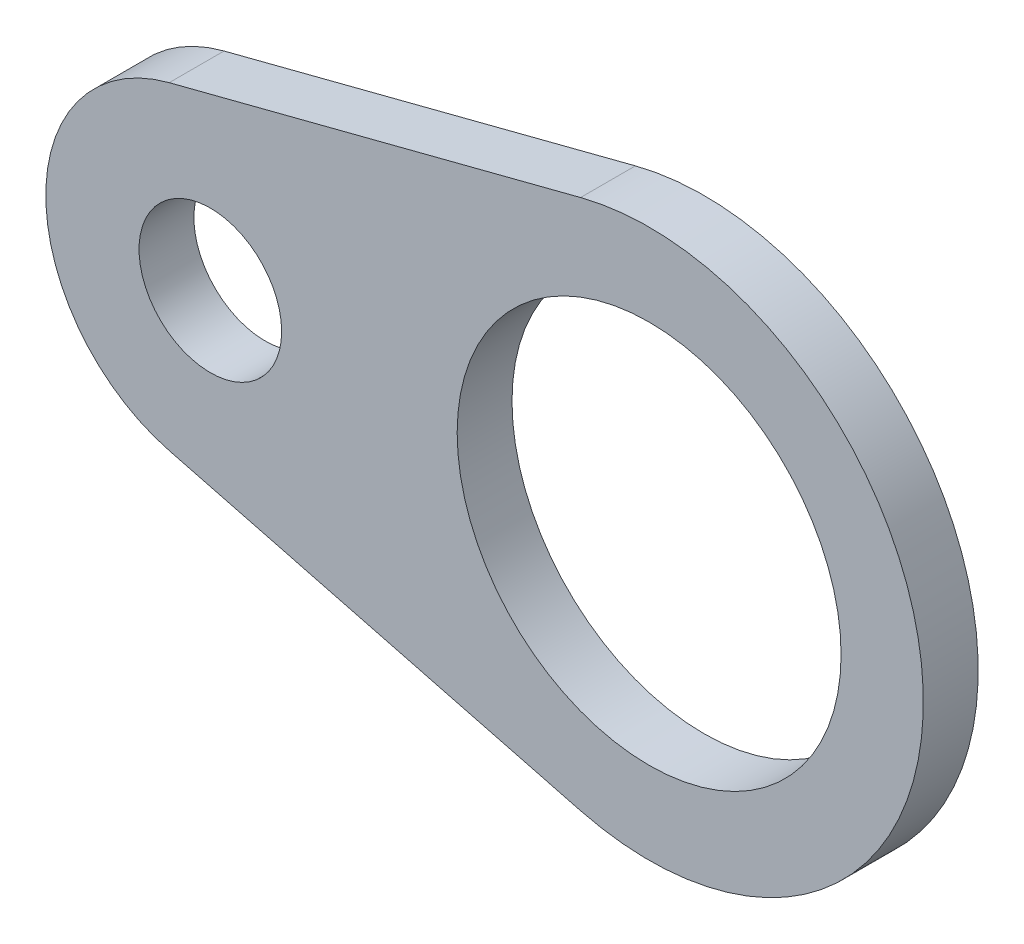
from build123d import *

# Parameters (mm, degrees)
SKETCH_1_R      = 17.5
SKETCH_1_R_2    = 6.5
EXTRUDE_1_DEPTH = 5


with BuildPart() as part:
    # 草图1 → 凸台-拉伸1 (new body)
    with BuildSketch(Plane.XY):
        with BuildLine():
            Line((-43.75, 14.523687548), (-6.25, 24.206145914))
            ThreePointArc((-6.25, 24.206145914), (25, 0), (-6.25, -24.206145914))
            Line((-6.25, -24.206145914), (-43.75, -14.523687548))
            ThreePointArc((-43.75, -14.523687548), (-55, 0), (-43.75, 14.523687548))
        make_face()
        Circle(SKETCH_1_R, mode=Mode.SUBTRACT)
        with Locations((-40, 0)):
            Circle(SKETCH_1_R_2, mode=Mode.SUBTRACT)
    extrude(amount=EXTRUDE_1_DEPTH)


solid = part.part
